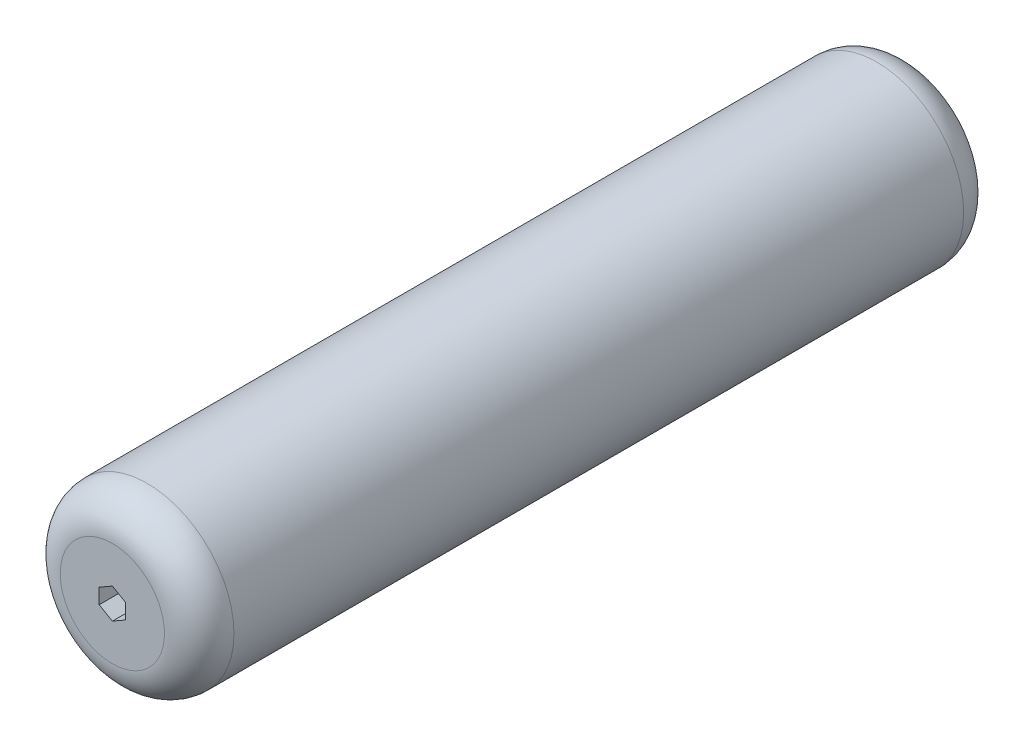
from build123d import *

# Parameters (mm, degrees)
SKETCH1_R           = 31.75
BOSS_EXTRUDE1_DEPTH = 292.1
FILLET1_R           = 12.7
FILLET2_R           = 12.7


with BuildPart() as part:
    # Sketch1 → Boss-Extrude1 (new body)
    with BuildSketch(Plane.XY):
        Circle(SKETCH1_R)
        Polygon((0, -5.55625), (4.81185365, -2.778125), (4.81185365, 2.778125), (0, 5.55625), (-4.81185365, 2.778125), (-4.81185365, -2.778125), align=None, mode=Mode.SUBTRACT)
    extrude(amount=BOSS_EXTRUDE1_DEPTH)

    # Fillet1
    fillet1_edges = [part.edges().sort_by_distance(p)[0] for p in [
        (-31.75, 0, 292.1),
    ]]
    fillet(fillet1_edges, radius=FILLET1_R)

    # Fillet2
    fillet2_edges = [part.edges().sort_by_distance(p)[0] for p in [
        (-31.75, 0, 0),
    ]]
    fillet(fillet2_edges, radius=FILLET2_R)


solid = part.part
